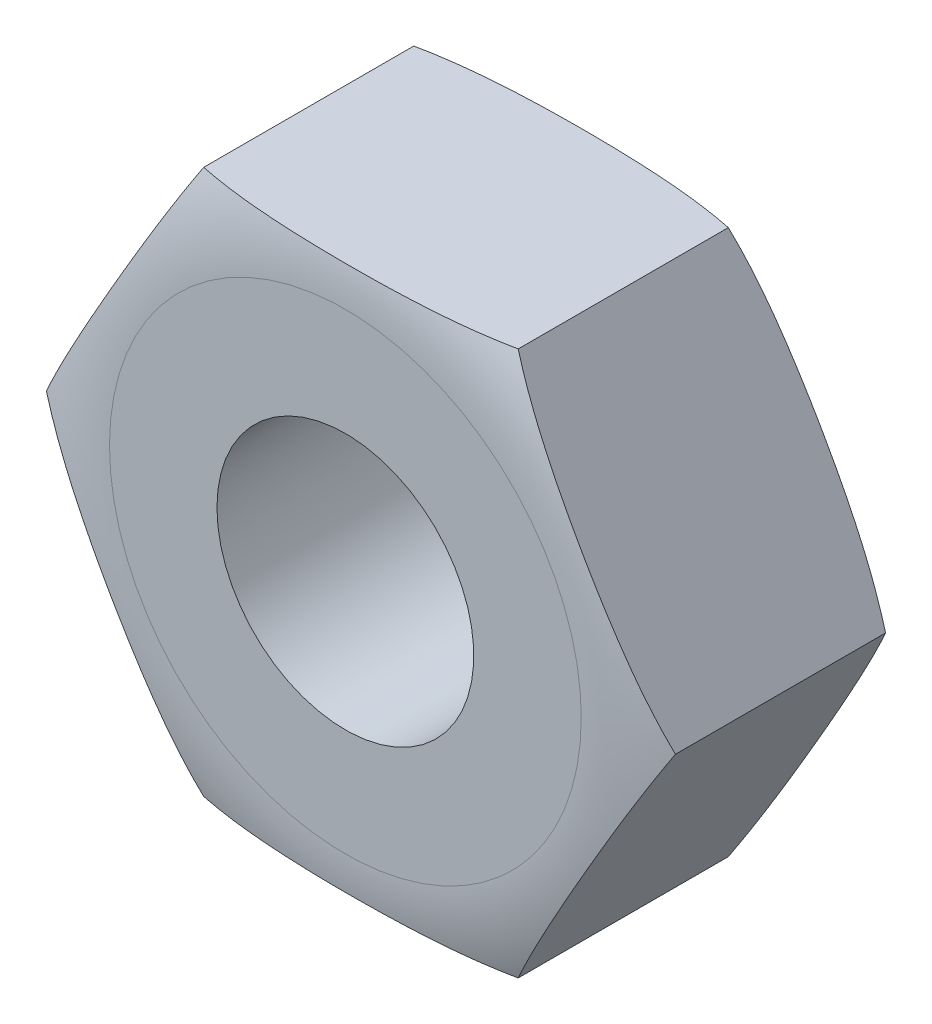
from build123d import *

# Parameters (mm, degrees)
EXTRUDE_319_DEPTH = 1.55
HOLE_WIZARD_1_D   = 3.3


with BuildPart() as part:
    # 草图1 → Extrude 319 (new, symmetric)
    with BuildSketch(Plane.XY):
        Polygon((2.020725942, 3.5), (-2.020725942, 3.5), (-4.041451884, 0), (-2.020725942, -3.5), (2.020725942, -3.5), (4.041451884, 0), align=None)
    extrude(amount=EXTRUDE_319_DEPTH, both=True)

    # 草图2 → 切除-旋转1 (revolve, cut)
    with BuildSketch(Plane(origin=(0, 0, 0), x_dir=(1, 0, 0), z_dir=(0, 1, 0))):
        with BuildLine():
            Line((3.031088913, 1.55), (4.041451884, 1.55))
            Line((4.041451884, 1.55), (4.041451884, 1.35))
            ThreePointArc((4.041451884, 1.35), (3.546072732, 1.499519571), (3.031088913, 1.55))
        make_face()
        with BuildLine():
            Line((4.041451884, -1.55), (4.041451884, -1.35))
            ThreePointArc((4.041451884, -1.35), (3.546072732, -1.499519571), (3.031088913, -1.55))
            Line((3.031088913, -1.55), (4.041451884, -1.55))
        make_face()
    revolve(axis=Axis((0, 0, 0), (0, 0, -1)), mode=Mode.SUBTRACT)

    # Hole Wizard 1 (through all)
    with Locations(Plane(origin=(0, 0, -1.55), x_dir=(-1, 0, 0), z_dir=(0, 0, -1))):
        with Locations((0, 0)):
            Hole(HOLE_WIZARD_1_D / 2)


solid = part.part
